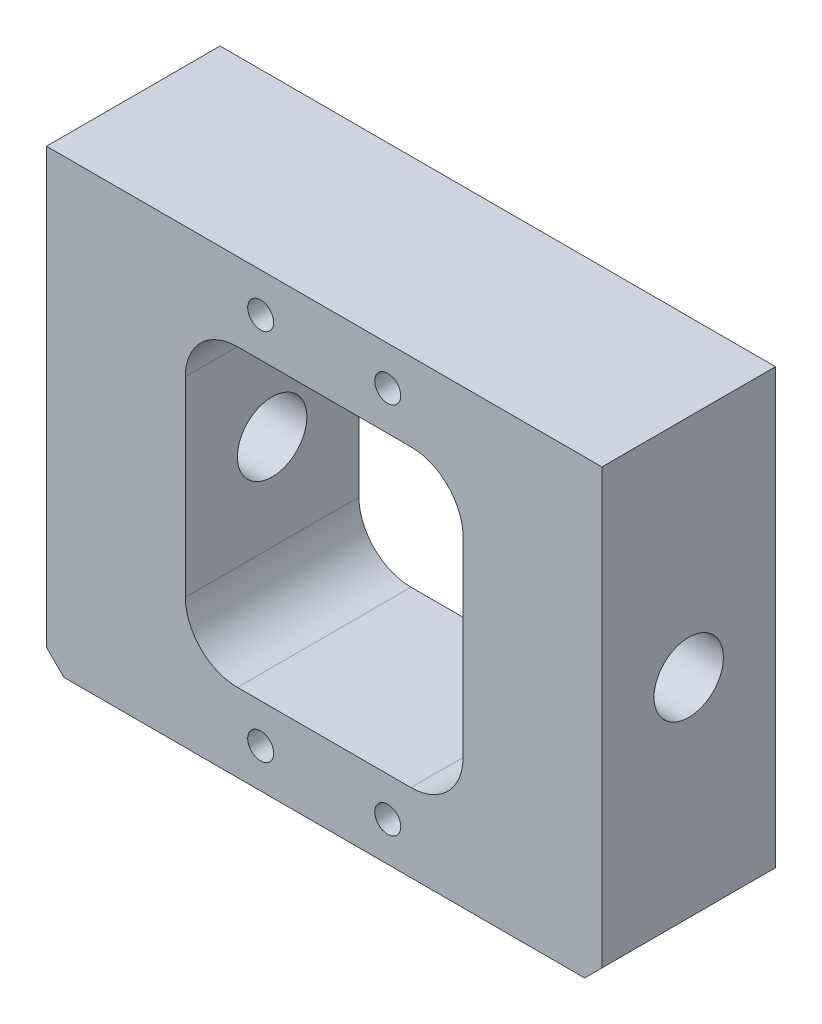
from build123d import *

# Parameters (mm, degrees)
SKETCH_1_W          = 32
SKETCH_1_H          = 26
EXTRUDE_1_DEPTH     = 10
SKETCH_2_W          = 16
SKETCH_2_H          = 17
CUT_EXTRUDE_2_DEPTH = 23.912878475
FILLET_1_R          = 3
SKETCH_3_R          = 2
CUT_EXTRUDE_3_DEPTH = 36.958309193
CHAMFER_1_SIZE      = 1
SKETCH_4_R          = 0.75
CUT_EXTRUDE_1_DEPTH = 23.912878475


with BuildPart() as part:
    # Эскиз1 → Вытянуть1 (new body)
    with BuildSketch(Plane.XY):
        Rectangle(SKETCH_1_W, SKETCH_1_H)
    extrude(amount=EXTRUDE_1_DEPTH)

    # Эскиз2 → Вытянуть2 (cut, through all)
    with BuildSketch(Plane.XY.offset(10)):
        Rectangle(SKETCH_2_W, SKETCH_2_H)
    extrude(amount=-CUT_EXTRUDE_2_DEPTH, mode=Mode.SUBTRACT)

    # Скругление1
    fillet_1_edges = [part.edges().sort_by_distance(p)[0] for p in [
        (8, 8.5, 5),
        (8, -8.5, 5),
        (-8, -8.5, 5),
        (-8, 8.5, 5),
    ]]
    fillet(fillet_1_edges, radius=FILLET_1_R)

    # Эскиз3 → Вытянуть3 (cut, through all)
    with BuildSketch(Plane.ZY.offset(16)):
        with Locations((5, 0)):
            Circle(SKETCH_3_R)
    extrude(amount=-CUT_EXTRUDE_3_DEPTH, mode=Mode.SUBTRACT)

    # Фаска1
    chamfer_1_edges = [part.edges().sort_by_distance(p)[0] for p in [
        (16, -13, 5),
        (-16, -13, 5),
    ]]
    chamfer(chamfer_1_edges, length=CHAMFER_1_SIZE)

    # Эскиз4 → Вырез-Вытянуть1 (cut, through all)
    with BuildSketch(Plane(origin=(0, 0, 0), x_dir=(-1, 0, 0), z_dir=(0, 0, -1))):
        with Locations((-3.66, 10.75)):
            Circle(SKETCH_4_R)
        with Locations(Location((3.66, 10.75, 0), (0, 0, 180))):
            Circle(SKETCH_4_R)
        with Locations((3.66, -10.75)):
            Circle(SKETCH_4_R)
        with Locations(Location((-3.66, -10.75, 0), (0, 0, 180))):
            Circle(SKETCH_4_R)
    extrude(amount=-CUT_EXTRUDE_1_DEPTH, mode=Mode.SUBTRACT)


solid = part.part
